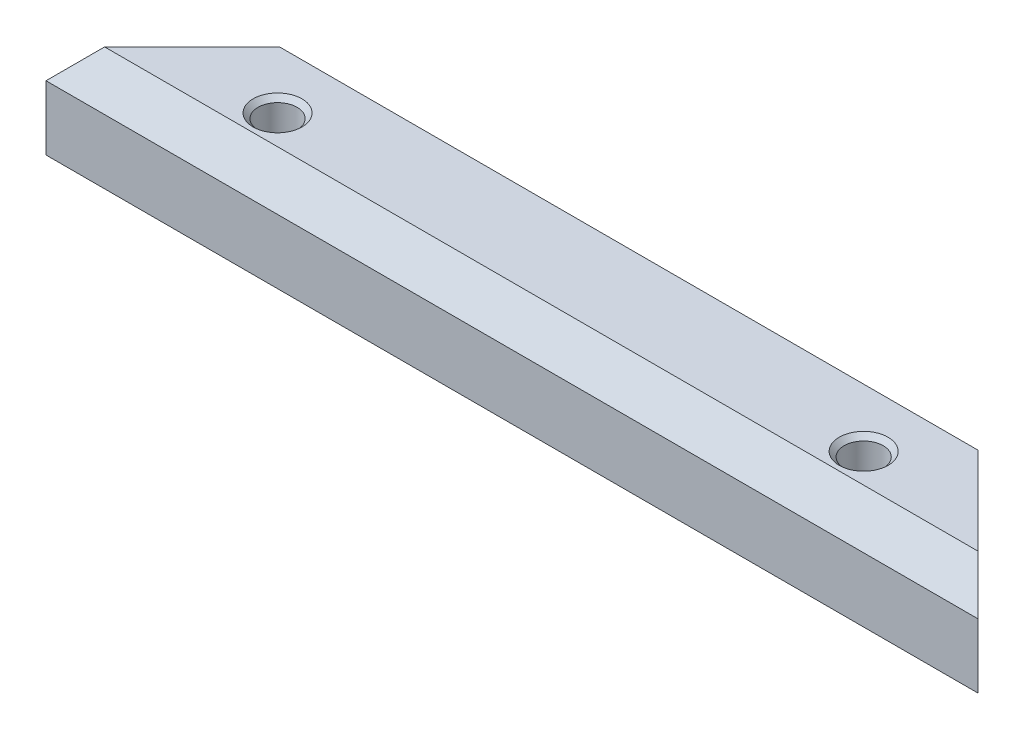
from build123d import *

# Parameters (mm, degrees)
BOSS_EXTRUDE1_DEPTH     = 3
BOSS_EXTRUDE2_DEPTH     = 12
BOSS_EXTRUDE3_DEPTH     = 4.17
CUT_EXTRUDE1_DEPTH      = 101.179165
CUT_EXTRUDE1_DEPTH_BACK = 101.179165
SKETCH3_R               = 2
CHAMFER1_SIZE           = 6
SKETCH8_R               = 4
CUT_EXTRUDE2_DEPTH      = 7.17
CHAMFER2_SIZE           = 1
CUT_EXTRUDE4_START      = -5
SKETCH9_R               = 4
CUT_EXTRUDE4_DEPTH      = 5
CHAMFER3_SIZE           = 2


with BuildPart() as part:
    # Sketch1 → Boss-Extrude1 (new body)
    with BuildSketch(Plane(origin=(0, 0, 0), x_dir=(1, 0, 0), z_dir=(0, 1, 0))):
        Polygon((-95.41, 0), (95.41, 0), (69.5, 25.91), (-69.5, 25.91), align=None)
    extrude(amount=BOSS_EXTRUDE1_DEPTH)

    # Sketch5 → Boss-Extrude2 (add)
    with BuildSketch(Plane(origin=(0, 3, 0), x_dir=(1, 0, 0), z_dir=(0, 1, 0))):
        with BuildLine():
            Line((-64.496944889, 25.91), (-69.5, 25.91))
            Line((-69.5, 25.91), (-95.41, 0))
            Line((-95.41, 0), (95.41, 0))
            Line((95.41, 0), (69.5, 25.91))
            Line((69.5, 25.91), (64.496944889, 25.91))
            ThreePointArc((64.496944889, 25.91), (54.829686624, 24.966540009), (45.527255216, 22.171764706))
            ThreePointArc((45.527255216, 22.171764706), (0, 13.2), (-45.527255216, 22.171764706))
            ThreePointArc((-45.527255216, 22.171764706), (-54.829686624, 24.966540009), (-64.496944889, 25.91))
        make_face()
    extrude(amount=BOSS_EXTRUDE2_DEPTH)

    # Sketch7 → Boss-Extrude3 (add)
    with BuildSketch(Plane(origin=(0, 15, 0), x_dir=(1, 0, 0), z_dir=(0, 1, 0))):
        Polygon((-95.41, 0), (-69.5, 25.91), (69.5, 25.91), (95.41, 0), align=None)
    extrude(amount=BOSS_EXTRUDE3_DEPTH)

    # Sketch3 → Cut-Extrude1 (cut, two sides: drawn at the far end of the back side and taken through both)
    with BuildSketch(Plane(origin=(0, 3, 0), x_dir=(1, 0, 0), z_dir=(0, 1, 0)).offset(-CUT_EXTRUDE1_DEPTH_BACK)):
        with Locations(Location((-60, 12, 0), (0, 0, 270))):
            Circle(SKETCH3_R)
        with Locations(Location((60, 12, 0), (0, 0, 90))):
            Circle(SKETCH3_R)
    extrude(amount=CUT_EXTRUDE1_DEPTH + CUT_EXTRUDE1_DEPTH_BACK, mode=Mode.SUBTRACT)

    # Chamfer1
    chamfer1_edges = [part.edges().sort_by_distance(p)[0] for p in [
        (0, 19.17, 0),
    ]]
    chamfer(chamfer1_edges, length=CHAMFER1_SIZE)

    # Sketch8 → Cut-Extrude2 (cut)
    with BuildSketch(Plane(origin=(0, 19.17, 0), x_dir=(1, 0, 0), z_dir=(0, 1, 0))):
        with Locations(Location((-60, 12, 0), (0, 0, 270))):
            Circle(SKETCH8_R)
        with Locations(Location((60, 12, 0), (0, 0, 270))):
            Circle(SKETCH8_R)
    extrude(amount=-CUT_EXTRUDE2_DEPTH, mode=Mode.SUBTRACT)

    # Chamfer2
    chamfer2_edges = [part.edges().sort_by_distance(p)[0] for p in [
        (-60, 19.17, -16),
        (60, 19.17, -16),
    ]]
    chamfer(chamfer2_edges, length=CHAMFER2_SIZE)

    # Sketch9 → Cut-Extrude4 (cut)
    with BuildSketch(Plane(origin=(0, 0, 0), x_dir=(-1, 0, 0), z_dir=(0, -1, 0)).offset(CUT_EXTRUDE4_START)):
        with Locations(Location((60, 12, 0), (0, 0, 270))):
            Circle(SKETCH9_R)
        with Locations(Location((30, 12, 0), (0, 0, 90))):
            Circle(SKETCH9_R)
        with Locations(Location((-30, 12, 0), (0, 0, 90))):
            Circle(SKETCH9_R)
        with Locations(Location((-60, 12, 0), (0, 0, 270))):
            Circle(SKETCH9_R)
    extrude(amount=CUT_EXTRUDE4_DEPTH, mode=Mode.SUBTRACT)

    # Chamfer3
    chamfer3_edges = [part.edges().sort_by_distance(p)[0] for p in [
        (0, 19.17, -25.91),
    ]]
    chamfer(chamfer3_edges, length=CHAMFER3_SIZE)


solid = part.part
